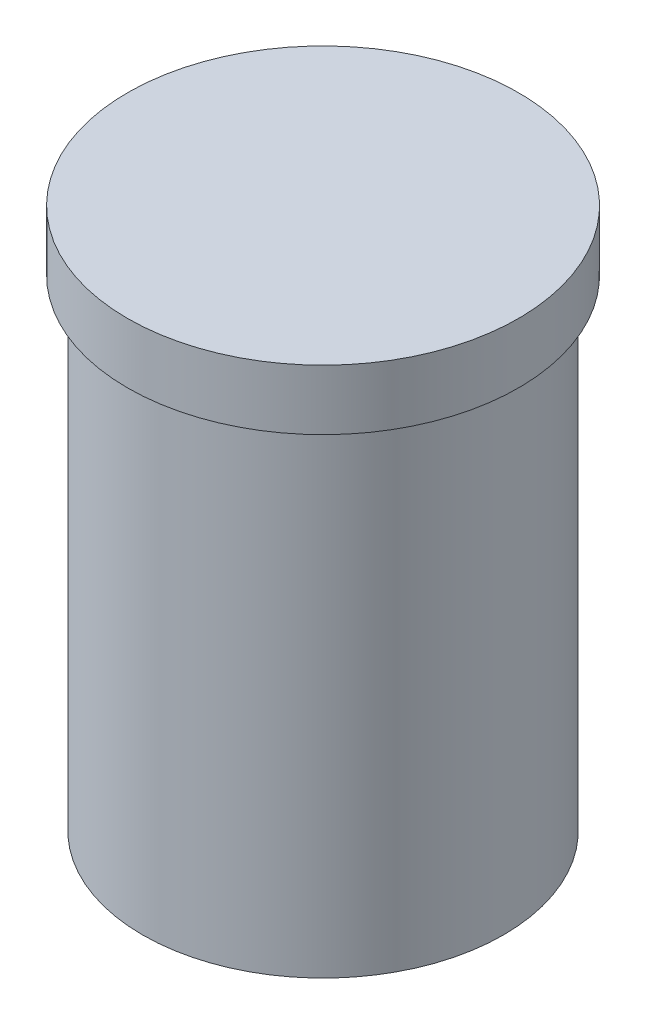
from build123d import *

# Parameters (mm, degrees)
SKETCH1_R           = 38.1
BOSS_EXTRUDE1_DEPTH = 101.6
SKETCH2_R           = 41.275
BOSS_EXTRUDE2_DEPTH = 12.7


with BuildPart() as part:
    # Sketch1 → Boss-Extrude1 (new body)
    with BuildSketch(Plane(origin=(0, 0, 0), x_dir=(1, 0, 0), z_dir=(0, 1, 0))):
        with Locations(Location((0, 0, 0), (0, 0, 270))):
            Circle(SKETCH1_R)
    extrude(amount=BOSS_EXTRUDE1_DEPTH)

    # Sketch2 → Boss-Extrude2 (add)
    with BuildSketch(Plane(origin=(0, 101.6, 0), x_dir=(1, 0, 0), z_dir=(0, 1, 0))):
        with Locations(Location((0, 0, 0), (0, 0, 270))):
            Circle(SKETCH2_R)
    extrude(amount=BOSS_EXTRUDE2_DEPTH)


solid = part.part
